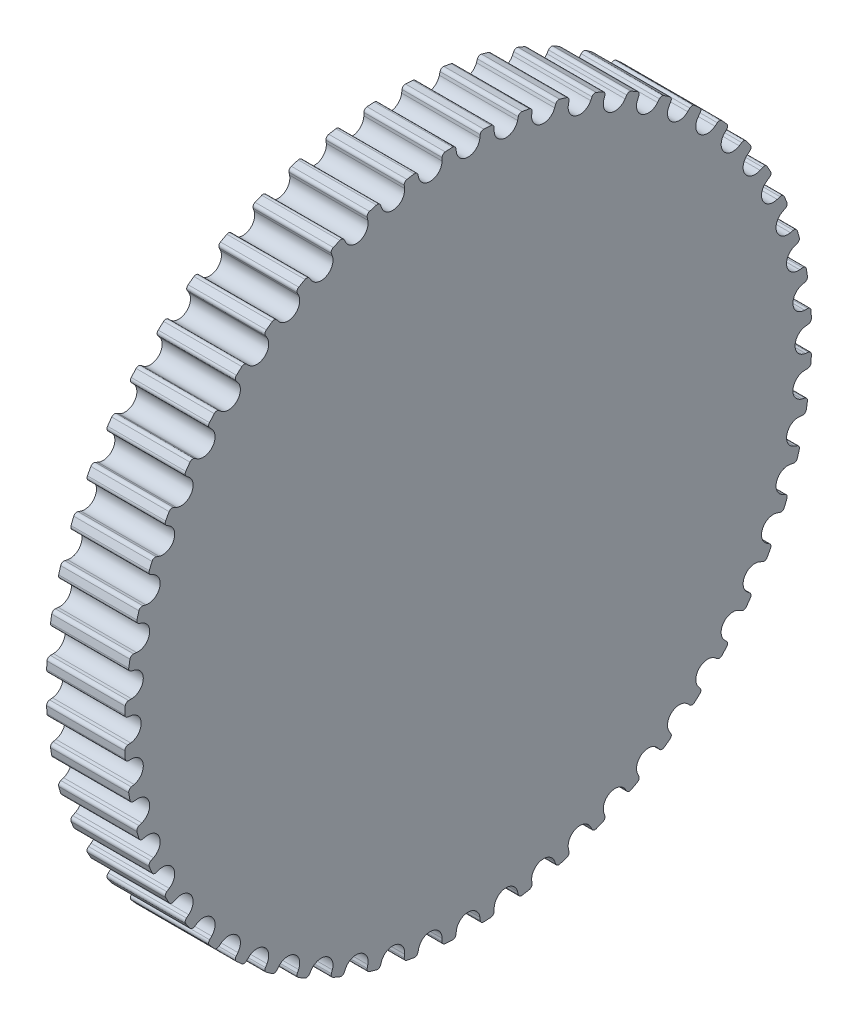
from build123d import *

# Parameters (mm, degrees)
CUT_EXTRUDE_2_REACH      = 39.757
PATTERN_CIRCULAR_3_COUNT = 56


with BuildPart() as part:
    # 草图1 → 旋转1 (revolve)
    with BuildSketch(Plane.XY):
        Polygon((0, 5.2718), (0, 26.359), (6, 26.359), (6, 10.5436), (6, 0), (0, 0), align=None)
    revolve(axis=Axis((0, 0, 0), (1, 0, 0)))

    # 草图6 → 切除-拉伸2 (cut, up to next)
    with BuildSketch(Plane(origin=(0, 0, 0), x_dir=(0, 0, -1), z_dir=(1, 0, 0)), mode=Mode.PRIVATE) as cut_extrude_2_sk1:
        with BuildLine():
            Line((0.930903788, 26.103589707), (0.903216998, 25.878098898))
            ThreePointArc((0.903216998, 25.878098898), (0, 25.079), (-0.903216998, 25.878098898))
            Line((-0.903216998, 25.878098898), (-0.930903788, 26.103589707))
            ThreePointArc((-0.930903788, 26.103589707), (-1.021165973, 26.270506855), (-1.200810345, 26.331633742))
            ThreePointArc((-1.200810345, 26.331633742), (-1.330660773, 26.32539122), (-1.460478834, 26.318508365))
            Line((-1.460478834, 26.318508365), (-1.657126823, 27.920077708))
            ThreePointArc((-1.657126823, 27.920077708), (0, 27.969211796), (1.657126823, 27.920077708))
            Line((1.657126823, 27.920077708), (1.460478834, 26.318508365))
            ThreePointArc((1.460478834, 26.318508365), (1.330660773, 26.32539122), (1.200810345, 26.331633742))
            ThreePointArc((1.200810345, 26.331633742), (1.021165973, 26.270506855), (0.930903788, 26.103589707))
        make_face()
    cut_extrude_2_tool1 = extrude(cut_extrude_2_sk1.sketch, amount=CUT_EXTRUDE_2_REACH, mode=Mode.PRIVATE) & part.part
    cut_extrude_2 = cut_extrude_2_tool1.solids().sort_by_distance((0, 26.777178, 0))[0]
    add(cut_extrude_2, mode=Mode.SUBTRACT)

    # 阵列(圆周)3: 切除-拉伸2 ×56 about axis
    pattern_circular_3_axis = Axis((-0.45, 0, 0), (1, 0, 0))
    for i in range(1, PATTERN_CIRCULAR_3_COUNT):
        add(cut_extrude_2.rotate(pattern_circular_3_axis, i * 360 / PATTERN_CIRCULAR_3_COUNT), mode=Mode.SUBTRACT)


solid = part.part
